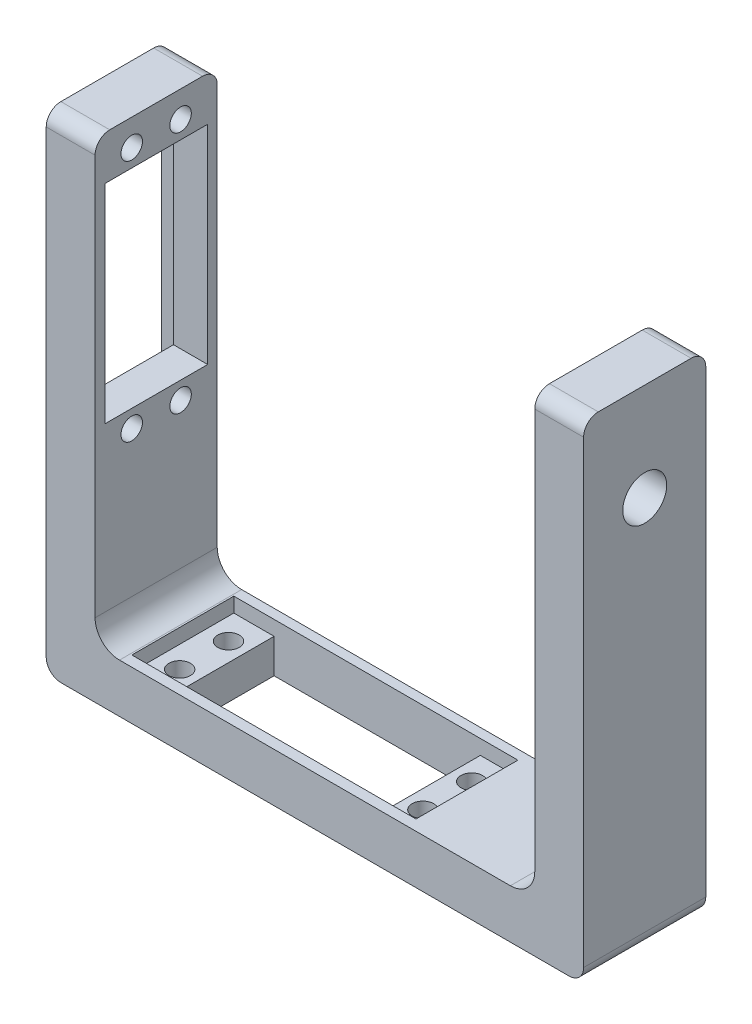
from build123d import *

# Parameters (mm, degrees)
BOSS_EXTRUDE1_DEPTH = 25
SKETCH2_R           = 2.2
CUT_EXTRUDE1_DEPTH  = 10
SKETCH4_W           = 21.020217786
SKETCH4_H           = 42.591039887
CUT_EXTRUDE2_DEPTH  = 14
SKETCH5_W           = 22.665717921
SKETCH5_H           = 57.45495938
CUT_EXTRUDE3_DEPTH  = 3
FILLET1_R           = 5
FILLET2_R           = 3
SKETCH6_R           = 4.5
CUT_EXTRUDE4_DEPTH  = 10
SKETCH8_W           = 42.21478983
SKETCH8_H           = 20.870122348
CUT_EXTRUDE5_DEPTH  = 21
SKETCH9_W           = 58.147470605
SKETCH9_H           = 20.870122348
CUT_EXTRUDE6_DEPTH  = 3
SKETCH10_R          = 2.2
CUT_EXTRUDE7_DEPTH  = 23


with BuildPart() as part:
    # Sketch1 → Boss-Extrude1 (new body)
    with BuildSketch(Plane.XY):
        Polygon((0, 100), (0, 0), (110, 0), (110, 100), (100, 100), (100, 10), (10, 10), (10, 100), align=None)
    extrude(amount=BOSS_EXTRUDE1_DEPTH)

    # Sketch2 → Cut-Extrude1 (cut)
    with BuildSketch(Plane.ZY):
        with Locations((7.5, 94.589613301)):
            Circle(SKETCH2_R)
        with Locations((17.5, 94.589613301)):
            Circle(SKETCH2_R)
        with Locations((7.5, 44.810386699)):
            Circle(SKETCH2_R)
        with Locations((17.5, 44.810386699)):
            Circle(SKETCH2_R)
    extrude(amount=-CUT_EXTRUDE1_DEPTH, mode=Mode.SUBTRACT)

    # Sketch4 → Cut-Extrude2 (cut)
    with BuildSketch(Plane(origin=(10, 0, 0), x_dir=(0, 0, -1), z_dir=(1, 0, 0))):
        with Locations((-12.458750101, 69.669580668)):
            Rectangle(SKETCH4_W, SKETCH4_H)
    extrude(amount=-CUT_EXTRUDE2_DEPTH, mode=Mode.SUBTRACT)

    # Sketch5 → Cut-Extrude3 (cut)
    with BuildSketch(Plane.ZY):
        with Locations((12.691576382, 69.375131892)):
            Rectangle(SKETCH5_W, SKETCH5_H)
    extrude(amount=-CUT_EXTRUDE3_DEPTH, mode=Mode.SUBTRACT)

    # Fillet1
    fillet1_edges = [part.edges().sort_by_distance(p)[0] for p in [
        (10, 10, 12.5),
        (100, 10, 12.5),
    ]]
    fillet(fillet1_edges, radius=FILLET1_R)

    # Fillet2
    fillet2_edges = [part.edges().sort_by_distance(p)[0] for p in [
        (5, 100, 0),
        (105, 100, 0),
        (110, 0, 12.5),
        (0, 0, 12.5),
        (5, 100, 25),
        (105, 100, 25),
    ]]
    fillet(fillet2_edges, radius=FILLET2_R)

    # Sketch6 → Cut-Extrude4 (cut)
    with BuildSketch(Plane(origin=(110, 0, 0), x_dir=(0, 0, -1), z_dir=(1, 0, 0))):
        with Locations((-12.5, 80)):
            Circle(SKETCH6_R)
    extrude(amount=-CUT_EXTRUDE4_DEPTH, mode=Mode.SUBTRACT)

    # Sketch8 → Cut-Extrude5 (cut)
    with BuildSketch(Plane.XZ):
        with Locations((44.714968541, 12.398762514)):
            Rectangle(SKETCH8_W, SKETCH8_H)
    extrude(amount=-CUT_EXTRUDE5_DEPTH, mode=Mode.SUBTRACT)

    # Sketch9 → Cut-Extrude6 (cut)
    with BuildSketch(Plane(origin=(0, 10, 0), x_dir=(1, 0, 0), z_dir=(0, 1, 0))):
        with Locations((44.434650342, -12.398762514)):
            Rectangle(SKETCH9_W, SKETCH9_H)
    extrude(amount=-CUT_EXTRUDE6_DEPTH, mode=Mode.SUBTRACT)

    # Sketch10 → Cut-Extrude7 (cut)
    with BuildSketch(Plane(origin=(0, 7, 0), x_dir=(1, 0, 0), z_dir=(0, 1, 0))):
        with Locations(Location((69.589613301, -7.5, 0), (0, 0, 270))):
            Circle(SKETCH10_R)
        with Locations(Location((69.589613301, -17.5, 0), (0, 0, 270))):
            Circle(SKETCH10_R)
        with Locations(Location((19.810386699, -7.5, 0), (0, 0, 270))):
            Circle(SKETCH10_R)
        with Locations(Location((19.810386699, -17.5, 0), (0, 0, 270))):
            Circle(SKETCH10_R)
    extrude(amount=-CUT_EXTRUDE7_DEPTH, mode=Mode.SUBTRACT)


solid = part.part
